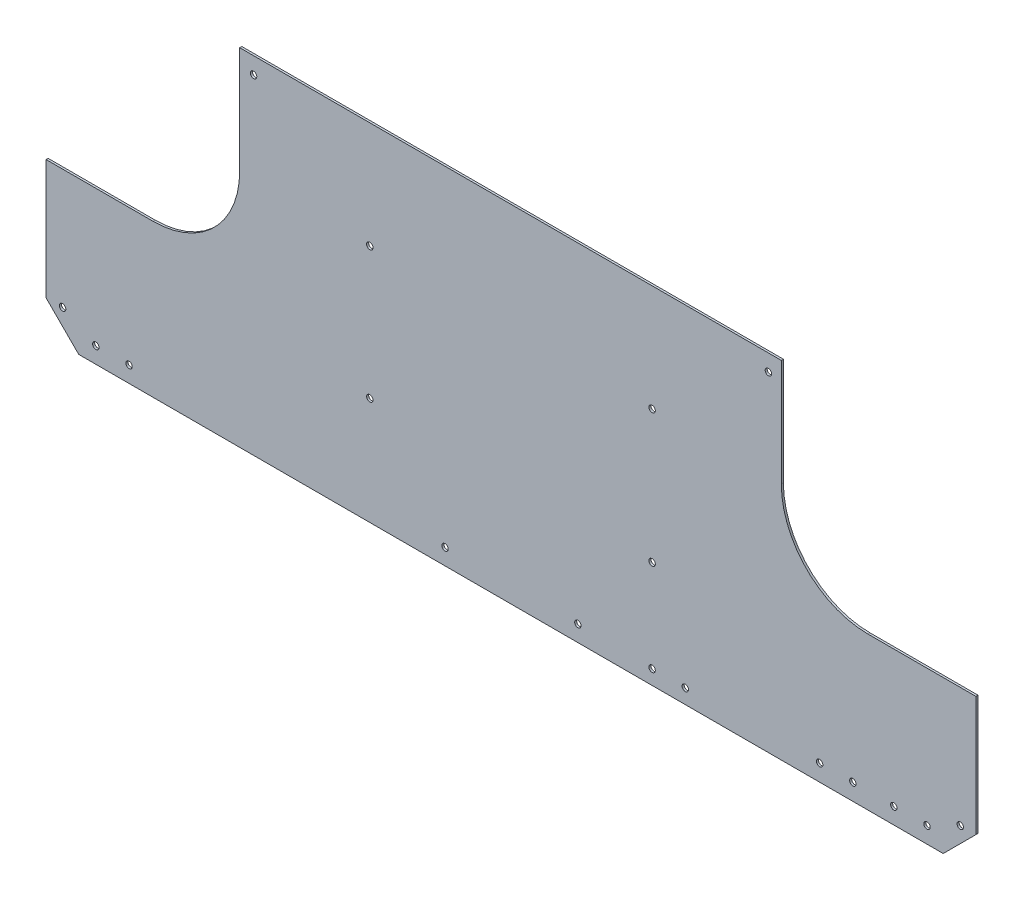
from build123d import *

# Parameters (mm, degrees)
SKETCH3_W                    = 914.4
SKETCH3_H                    = 609.6
BOSS_EXTRUDE1_DEPTH          = 0.79375
SKETCH4_OUTSIDE_W            = 1136.194
SKETCH4_OUTSIDE_H            = 831.394
CUT_EXTRUDE1_DEPTH           = 2.54
CUT_EXTRUDE2_DEPTH           = 2.54
CUT_EXTRUDE3_DEPTH           = 2.54
F_10_0_1935_DIAMETER_HOLE1_D = 4.9149
F_10_0_1935_DIAMETER_HOLE2_D = 4.9149


with BuildPart() as part:
    # Sketch3 → Boss-Extrude1 (new, symmetric)
    with BuildSketch(Plane.XY):
        Rectangle(SKETCH3_W, SKETCH3_H)
    extrude(amount=BOSS_EXTRUDE1_DEPTH, both=True)

    # Sketch4 outside → Cut-Extrude1 (cut)
    with BuildSketch(Plane.XY.offset(0.79375)):
        Rectangle(SKETCH4_OUTSIDE_W, SKETCH4_OUTSIDE_H)
        with BuildLine():
            Line((-352.134938229, -305.170644008), (-377.534938229, -279.770644008))
            Line((-377.534938229, -279.770644008), (-377.534938229, -42.598144008))
            ThreePointArc((-377.534938229, -42.598144008), (-376.790989453, -40.802092784), (-374.994938229, -40.058144008))
            Line((-374.994938229, -40.058144008), (331.125061771, -40.058144008))
            ThreePointArc((331.125061771, -40.058144008), (332.921112995, -40.802092784), (333.665061771, -42.598144008))
            Line((333.665061771, -42.598144008), (333.665061771, -279.770644008))
            Line((333.665061771, -279.770644008), (308.265061771, -305.170644008))
            Line((308.265061771, -305.170644008), (-352.134938229, -305.170644008))
        make_face(mode=Mode.SUBTRACT)
    extrude(amount=-CUT_EXTRUDE1_DEPTH, mode=Mode.SUBTRACT)

    # Sketch7 → Cut-Extrude2 (cut)
    with BuildSketch(Plane.XY.offset(0.79375)):
        with BuildLine():
            Line((-377.534938229, -188.190344021), (-377.534938229, -40.058144008))
            Line((-377.534938229, -40.058144008), (-229.402738216, -40.058144008))
            Line((-229.402738216, -40.058144008), (-229.402738216, -64.746344021))
            Line((-229.402738216, -64.746344021), (-229.402738216, -121.896344021))
            ThreePointArc((-229.402738216, -121.896344021), (-248.819801264, -168.773280973), (-295.696738216, -188.190344021))
            Line((-295.696738216, -188.190344021), (-352.846738216, -188.190344021))
            Line((-352.846738216, -188.190344021), (-377.534938229, -188.190344021))
        make_face()
    extrude(amount=-CUT_EXTRUDE2_DEPTH, mode=Mode.SUBTRACT)

    # Sketch8 → Cut-Extrude3 (cut)
    with BuildSketch(Plane.XY.offset(0.79375)):
        with BuildLine():
            Line((251.115061771, -188.190344021), (336.840061771, -188.190344021))
            Line((336.840061771, -188.190344021), (336.840061771, -36.171344021))
            Line((336.840061771, -36.171344021), (184.821061771, -36.171344021))
            Line((184.821061771, -36.171344021), (184.821061771, -121.896344021))
            ThreePointArc((184.821061771, -121.896344021), (204.238124819, -168.773280973), (251.115061771, -188.190344021))
        make_face()
    extrude(amount=-CUT_EXTRUDE3_DEPTH, mode=Mode.SUBTRACT)

    # #10 (0.1935) Diameter Hole1 (through all)
    with Locations(Plane.XY.offset(0.79375)):
        with Locations((-314.034938229, -292.470644008), (-339.434938229, -292.470644008), (-364.834938229, -279.770644008), (86.005546883, -293.702239208), (111.405546883, -293.702239208), (214.149530262, -292.114748821), (239.549530262, -292.114748821), (296.276261771, -292.470644008), (270.876261771, -292.470644008), (321.676261771, -279.770644008), (174.915061771, -52.758144008), (-218.784938229, -52.758144008), (-72.379338229, -292.470644008), (29.220661771, -292.470644008)):
            Hole(F_10_0_1935_DIAMETER_HOLE1_D / 2)

    # #10 (0.1935) Diameter Hole2 (through all)
    with Locations(Plane.XY.offset(0.79375)):
        with Locations((-129.88493833, -121.629072033), (-129.88493833, -222.541034234), (86.015061873, -223.229071976), (86.015061873, -121.629072033)):
            Hole(F_10_0_1935_DIAMETER_HOLE2_D / 2)


solid = part.part
